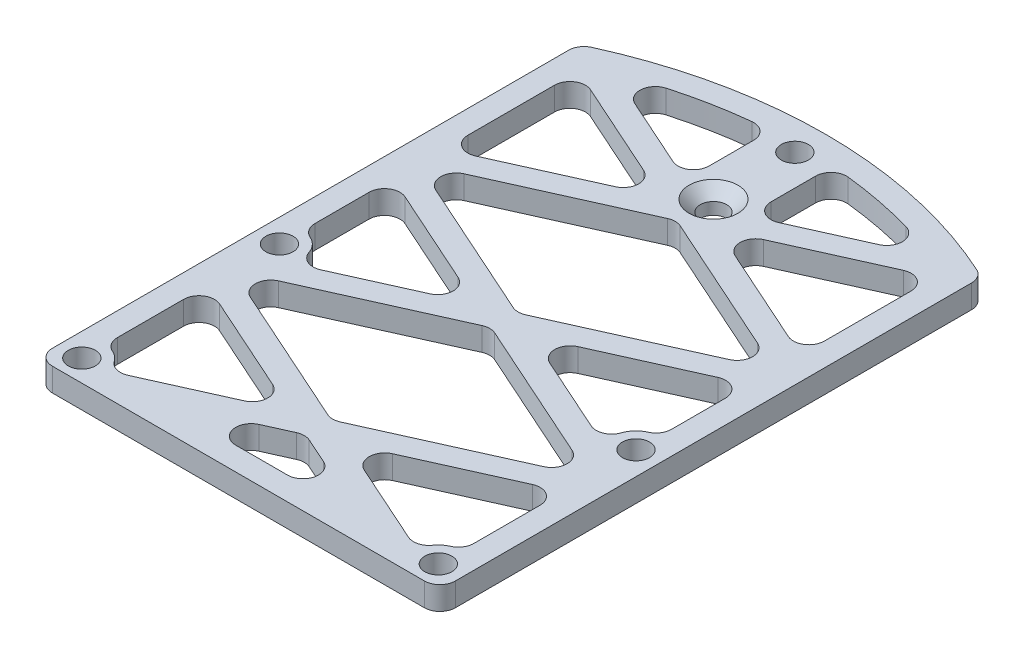
from build123d import *

# Parameters (mm, degrees)
BOSS_EXTRUDE1_DEPTH = 3
SKETCH2_R           = 1.75
CUT_EXTRUDE1_DEPTH  = 66.459911396
SKETCH3_R           = 1.75
CUT_EXTRUDE2_DEPTH  = 66.459911396
CUT_EXTRUDE3_DEPTH  = 66.459911396
FILLET1_R           = 2


with BuildPart() as part:
    # Sketch1 → Boss-Extrude1 (new body)
    with BuildSketch(Plane(origin=(0, 0, 0), x_dir=(1, 0, 0), z_dir=(0, 1, 0))):
        with BuildLine():
            Line((-26, -15.8), (26, -15.8))
            Line((26, -15.8), (26, 54.074023338))
            ThreePointArc((26, 54.074023338), (0, 60), (-26, 54.074023338))
            Line((-26, 54.074023338), (-26, -15.8))
        make_face()
    extrude(amount=BOSS_EXTRUDE1_DEPTH)

    # Sketch2 → Cut-Extrude1 (cut, through all)
    with BuildSketch(Plane(origin=(0, 3, 0), x_dir=(1, 0, 0), z_dir=(0, 1, 0))):
        with Locations(Location((-23, -13, 0), (0, 0, 270))):
            Circle(SKETCH2_R)
        with Locations(Location((-23, 12.5, 0), (0, 0, 270))):
            Circle(SKETCH2_R)
        with Locations(Location((23, -13, 0), (0, 0, 270))):
            Circle(SKETCH2_R)
        with Locations(Location((23, 12.5, 0), (0, 0, 270))):
            Circle(SKETCH2_R)
    extrude(amount=-CUT_EXTRUDE1_DEPTH, mode=Mode.SUBTRACT)

    # Sketch3 → Cut-Extrude2 (cut, through all)
    with BuildSketch(Plane(origin=(0, 3, 0), x_dir=(1, 0, 0), z_dir=(0, 1, 0))):
        with Locations(Location((0, 56, 0), (0, 0, 270))):
            Circle(SKETCH3_R)
    extrude(amount=-CUT_EXTRUDE2_DEPTH, mode=Mode.SUBTRACT)

    # Sketch4 → Cut-Extrude3 (cut, through all)
    with BuildSketch(Plane(origin=(0, 3, 0), x_dir=(1, 0, 0), z_dir=(0, 1, 0))):
        with BuildLine():
            Line((-4, 56.859475903), (-4, 45.835789761))
            Line((-4, 45.835789761), (-20.43478188, 53.211086152))
            ThreePointArc((-20.43478188, 53.211086152), (-12.352826734, 55.645374216), (-4, 56.859475903))
        make_face()
        with BuildLine():
            Line((4, 56.859475903), (4, 45.835789761))
            Line((4, 45.835789761), (20.43478188, 53.211086152))
            ThreePointArc((20.43478188, 53.211086152), (12.352826734, 55.645374216), (4, 56.859475903))
        make_face()
        Polygon((-23, 51.074023338), (-3.66367684, 42.396627103), (-23, 33.719230867), align=None)
        Polygon((3.66367684, 42.396627103), (23, 51.074023338), (23, 33.719230867), align=None)
        Polygon((0, 40.752510206), (-23, 30.430997074), (0, 20.109483942), (23, 30.430997074), align=None)
        with BuildLine():
            Line((-23, 27.142763282), (-3.66367684, 18.465367046))
            Line((-3.66367684, 18.465367046), (-20.439245255, 10.937138798))
            ThreePointArc((-20.439245255, 10.937138798), (-20.383840257, 13.968233019), (-23, 15.5))
            Line((-23, 15.5), (-23, 27.142763282))
        make_face()
        with BuildLine():
            Line((3.66367684, 18.465367046), (23, 27.142763282))
            Line((23, 27.142763282), (23, 15.5))
            ThreePointArc((23, 15.5), (20.383840257, 13.968233019), (20.439245255, 10.937138798))
            Line((20.439245255, 10.937138798), (3.66367684, 18.465367046))
        make_face()
        Polygon((0, 16.821250149), (-23, 6.499737017), (0, -3.821776115), (23, 6.499737017), align=None)
        with BuildLine():
            Line((23, 3.211503225), (3.66367684, -5.465893011))
            Line((3.66367684, -5.465893011), (20.006674091, -12.8))
            ThreePointArc((20.006674091, -12.8), (20.950609847, -10.80910977), (23, -10))
            Line((23, -10), (23, 3.211503225))
        make_face()
        with BuildLine():
            Line((-23, -10), (-23, 3.211503225))
            Line((-23, 3.211503225), (-3.66367684, -5.465893011))
            Line((-3.66367684, -5.465893011), (-20.006674091, -12.8))
            ThreePointArc((-20.006674091, -12.8), (-20.950609847, -10.80910977), (-23, -10))
        make_face()
        Polygon((-12.679320411, -12.8), (0, -7.110009907), (12.679320411, -12.8), align=None)
    extrude(amount=-CUT_EXTRUDE3_DEPTH, mode=Mode.SUBTRACT)

    # Fillet1
    fillet1_edges = [part.edges().sort_by_distance(p)[0] for p in [
        (20.439245255, 1.5, -10.937138798),
        (3.66367684, 1.5, -18.465367046),
        (23, 1.5, -27.142763282),
        (23, 1.5, -15.5),
        (0, 1.5, -16.821250149),
        (23, 1.5, -6.499737017),
        (0, 1.5, 3.821776115),
        (-23, 1.5, -6.499737017),
        (23, 1.5, -3.211503225),
        (23, 1.5, 10),
        (20.006674091, 1.5, 12.8),
        (3.66367684, 1.5, 5.465893011),
        (-20.006674091, 1.5, 12.8),
        (-23, 1.5, 10),
        (-23, 1.5, -3.211503225),
        (-3.66367684, 1.5, 5.465893011),
        (12.679320411, 1.5, 12.8),
        (-12.679320411, 1.5, 12.8),
        (0, 1.5, 7.110009907),
        (4, 1.5, -56.859475903),
        (20.43478188, 1.5, -53.211086152),
        (4, 1.5, -45.835789761),
        (-20.43478188, 1.5, -53.211086152),
        (-4, 1.5, -56.859475903),
        (-4, 1.5, -45.835789761),
        (-23, 1.5, -33.719230867),
        (-23, 1.5, -51.074023338),
        (-3.66367684, 1.5, -42.396627103),
        (23, 1.5, -33.719230867),
        (3.66367684, 1.5, -42.396627103),
        (23, 1.5, -51.074023338),
        (-26, 1.5, -54.074023338),
        (26, 1.5, -54.074023338),
        (26, 1.5, 15.8),
        (-26, 1.5, 15.8),
        (0, 1.5, -40.752510206),
        (23, 1.5, -30.430997074),
        (0, 1.5, -20.109483942),
        (-23, 1.5, -30.430997074),
        (-23, 1.5, -15.5),
        (-23, 1.5, -27.142763282),
        (-3.66367684, 1.5, -18.465367046),
        (-20.439245255, 1.5, -10.937138798),
    ]]
    fillet(fillet1_edges, radius=FILLET1_R)

    # Sketch5 → CSK for M3 Countersunk Flat Head Screw1 (revolve, cut)
    with BuildSketch(Plane(origin=(0, 3, -45.5), x_dir=(0, 0, 1), z_dir=(1, 0, 0))):
        Polygon((0, 0), (0, 3), (1.7, 3), (1.7, 1.45), (3.15, 0), align=None)
    revolve(axis=Axis((0, 9.35, -45.5), (0, -1, 0)), mode=Mode.SUBTRACT)


solid = part.part
